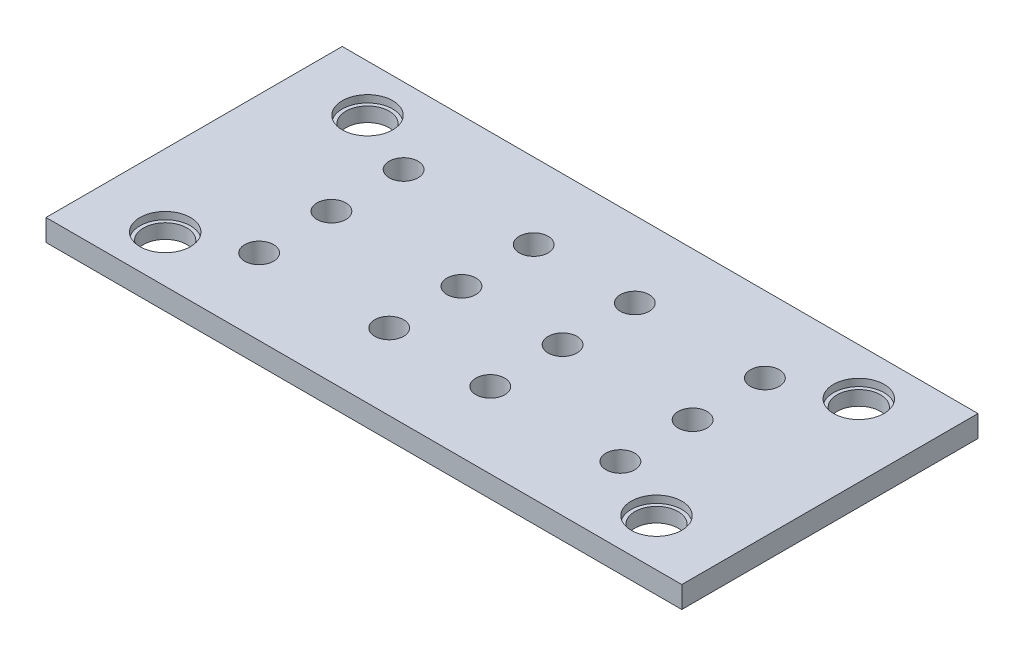
from build123d import *

# Parameters (mm, degrees)
SKETCH1_W           = 880
SKETCH1_H           = 410
BOSS_EXTRUDE1_DEPTH = 30
SKETCH2_R           = 30
CUT_EXTRUDE1_DEPTH  = 225
SKETCH3_R           = 35
CUT_EXTRUDE2_DEPTH  = 10
SKETCH4_R           = 20
CUT_EXTRUDE3_DEPTH  = 154


with BuildPart() as part:
    # Sketch1 → Boss-Extrude1 (new body)
    with BuildSketch(Plane(origin=(0, 0, 0), x_dir=(1, 0, 0), z_dir=(0, 1, 0))):
        Rectangle(SKETCH1_W, SKETCH1_H)
    extrude(amount=BOSS_EXTRUDE1_DEPTH)

    # Sketch2 → Cut-Extrude1 (cut)
    with BuildSketch(Plane(origin=(0, 30, 0), x_dir=(1, 0, 0), z_dir=(0, 1, 0))):
        with Locations(Location((-340, 140, 0), (0, 0, 270))):
            Circle(SKETCH2_R)
        with Locations(Location((340, 140, 0), (0, 0, 270))):
            Circle(SKETCH2_R)
        with Locations(Location((340, -140, 0), (0, 0, 270))):
            Circle(SKETCH2_R)
        with Locations(Location((-340, -140, 0), (0, 0, 270))):
            Circle(SKETCH2_R)
    extrude(amount=-CUT_EXTRUDE1_DEPTH, mode=Mode.SUBTRACT)

    # Sketch3 → Cut-Extrude2 (cut)
    with BuildSketch(Plane(origin=(0, 30, 0), x_dir=(1, 0, 0), z_dir=(0, 1, 0))):
        with Locations(Location((-340, 140, 0), (0, 0, 270))):
            Circle(SKETCH3_R)
        with Locations((-340, -540)):
            Circle(SKETCH3_R)
        with Locations((-340, -820)):
            Circle(SKETCH3_R)
        with Locations(Location((-340, -140, 0), (0, 0, 270))):
            Circle(SKETCH3_R)
        with Locations(Location((340, 140, 0), (0, 0, 270))):
            Circle(SKETCH3_R)
        with Locations(Location((340, -140, 0), (0, 0, 270))):
            Circle(SKETCH3_R)
    extrude(amount=-CUT_EXTRUDE2_DEPTH, mode=Mode.SUBTRACT)

    # Sketch4 → Cut-Extrude3 (cut)
    with BuildSketch(Plane(origin=(0, 30, 0), x_dir=(1, 0, 0), z_dir=(0, 1, 0))):
        with Locations(Location((-250, 0, 0), (0, 0, 270))):
            Circle(SKETCH4_R)
        with Locations(Location((-70, 0, 0), (0, 0, 270))):
            Circle(SKETCH4_R)
        with Locations(Location((-250, 100, 0), (0, 0, 270))):
            Circle(SKETCH4_R)
        with Locations(Location((-250, -100, 0), (0, 0, 270))):
            Circle(SKETCH4_R)
        with Locations(Location((-70, 100, 0), (0, 0, 270))):
            Circle(SKETCH4_R)
        with Locations(Location((-70, -100, 0), (0, 0, 270))):
            Circle(SKETCH4_R)
        with Locations(Location((70, -100, 0), (0, 0, 270))):
            Circle(SKETCH4_R)
        with Locations(Location((70, 100, 0), (0, 0, 270))):
            Circle(SKETCH4_R)
        with Locations(Location((250, -100, 0), (0, 0, 270))):
            Circle(SKETCH4_R)
        with Locations(Location((250, 100, 0), (0, 0, 270))):
            Circle(SKETCH4_R)
        with Locations(Location((70, 0, 0), (0, 0, 270))):
            Circle(SKETCH4_R)
        with Locations(Location((250, 0, 0), (0, 0, 270))):
            Circle(SKETCH4_R)
    extrude(amount=-CUT_EXTRUDE3_DEPTH, mode=Mode.SUBTRACT)


solid = part.part
